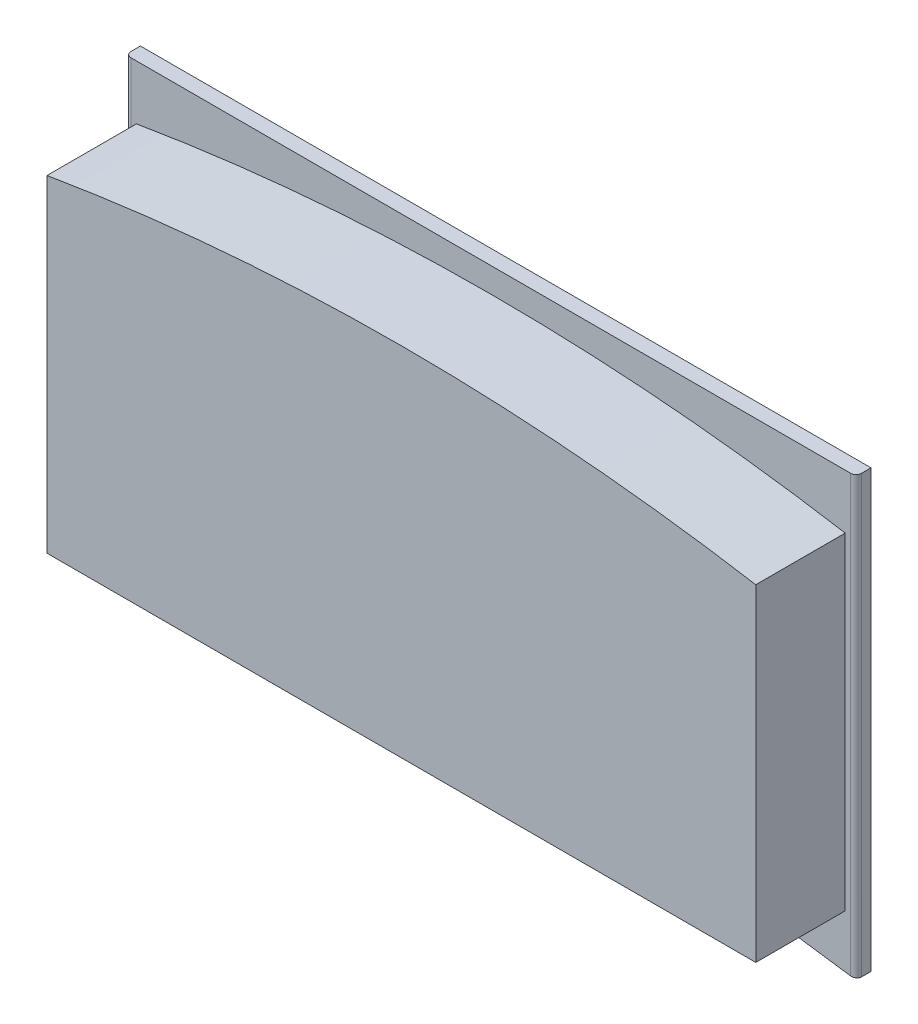
from build123d import *

# Parameters (mm, degrees)
BOSS_EXTRUDE1_DEPTH = 1.366666667
BOSS_EXTRUDE2_DEPTH = 8.2
FILLET1_R           = 0.5


with BuildPart() as part:
    # Sketch1 → Boss-Extrude1 (new body)
    with BuildSketch(Plane.XY):
        with BuildLine():
            Line((-33.5, 20), (-33.5, -20))
            ThreePointArc((-33.5, -20), (0, -17.434472888), (33.5, -20))
            Line((33.5, -20), (33.5, 20))
            Line((33.5, 20), (-33.5, 20))
        make_face()
    extrude(amount=BOSS_EXTRUDE1_DEPTH)

    # Sketch2 → Boss-Extrude2 (add)
    with BuildSketch(Plane.XY.offset(1.366666667)):
        with BuildLine():
            Line((32.5, -15), (-32.5, -15))
            Line((-32.5, -15), (-32.5, 15))
            ThreePointArc((-32.5, 15), (0, 17.727407049), (32.5, 15))
            Line((32.5, 15), (32.5, -15))
        make_face()
    extrude(amount=BOSS_EXTRUDE2_DEPTH)

    # Fillet1
    fillet1_edges = [part.edges().sort_by_distance(p)[0] for p in [
        (33.5, 0, 1.366666667),
        (-33.5, 0, 1.366666667),
    ]]
    fillet(fillet1_edges, radius=FILLET1_R)


solid = part.part
